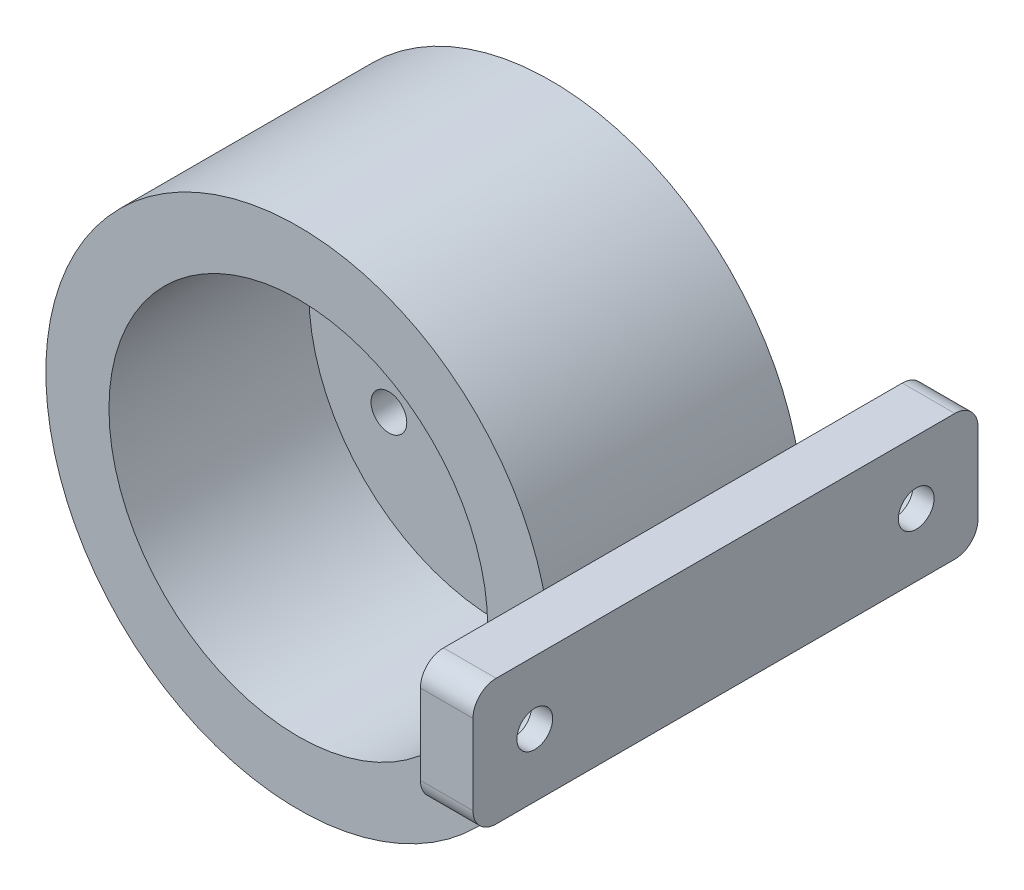
from build123d import *

# Parameters (mm, degrees)
SKETCH_1_R                = 12
EXTRUDE_1_DEPTH           = 12
SKETCH_1_4_R              = 0.85
CUT_EXTRUDE_2_DEPTH       = 2.5
SKETCH_1_5_R              = 4
EXTRUDE_2_DEPTH           = 4
SKETCH_1_6_R              = 4.3
EXTRUDE_3_DEPTH           = 0.5
SKETCH_1_7_R              = 2
CUT_EXTRUDE_3_DEPTH       = 4
SKETCH_1_8_R              = 1.5
CUT_EXTRUDE_5_DEPTH       = 1
CUT_EXTRUDE_START         = 12
SKETCH_1_10_R             = 9
CUT_EXTRUDE_6_DEPTH       = 9.5
EXTRUDE_8_DEPTH           = 0.3
EXTRUDE_8_DEPTH_BACK      = 2.2
CUT_EXTRUDE_START_2       = -2.2
CUT_EXTRUDE_20_DEPTH      = 1.5
CUT_EXTRUDE_21_DEPTH      = 1
CUT_EXTRUDE_21_DEPTH_BACK = 2
SKETCH_3_10_R             = 0.85
FILLET_3_R                = 1.1


with BuildPart() as part:
    # 草图1 → 凸台-拉伸1 (new body)
    with BuildSketch(Plane.XY):
        Circle(SKETCH_1_R)
    extrude(amount=EXTRUDE_1_DEPTH)

    # 草图1<4> → 切除-拉伸2 (cut)
    with BuildSketch(Plane.XY):
        with Locations((0, 6)):
            Circle(SKETCH_1_4_R)
        with Locations((-5.196152423, -3)):
            Circle(SKETCH_1_4_R)
        with Locations(Location((5.196152423, -3, 0), (0, 0, 180))):
            Circle(SKETCH_1_4_R)
    extrude(amount=CUT_EXTRUDE_2_DEPTH, mode=Mode.SUBTRACT)

    # 草图1<5> → 凸台-拉伸2 (add)
    with BuildSketch(Plane.XY):
        Circle(SKETCH_1_5_R)
    extrude(amount=-EXTRUDE_2_DEPTH)

    # 草图1<6> → 凸台-拉伸3 (add)
    with BuildSketch(Plane.XY):
        Circle(SKETCH_1_6_R)
    extrude(amount=-EXTRUDE_3_DEPTH)

    # 草图1<7> → 切除-拉伸3 (cut)
    with BuildSketch(Plane.XY):
        Circle(SKETCH_1_7_R)
    extrude(amount=-CUT_EXTRUDE_3_DEPTH, mode=Mode.SUBTRACT)

    # 草图1<8> → 切除-拉伸5 (cut)
    with BuildSketch(Plane.XY):
        with Locations((-5.196152423, -3)):
            Circle(SKETCH_1_8_R)
        with Locations((5.196152423, -3)):
            Circle(SKETCH_1_8_R)
        with Locations((0, 6)):
            Circle(SKETCH_1_8_R)
    extrude(amount=CUT_EXTRUDE_5_DEPTH, mode=Mode.SUBTRACT)

    # 草图1<10> → 切除-拉伸6 (cut)
    with BuildSketch(Plane.XY.offset(CUT_EXTRUDE_START)):
        Circle(SKETCH_1_10_R)
    extrude(amount=-CUT_EXTRUDE_6_DEPTH, mode=Mode.SUBTRACT)

    # 草图3 → 凸台-拉伸8 (add, two sides: drawn at the far end of the back side and taken through both)
    with BuildSketch(Plane(origin=(14, 0, 0), x_dir=(0, 0, -1), z_dir=(1, 0, 0)).offset(-EXTRUDE_8_DEPTH_BACK)):
        Polygon((-18, -3), (-12, -3), (-6, -3), (-6, 3), (-18, 3), align=None)
        Polygon((-6, 3), (-6, -3), (0, -3), (6, -3), (6, 3), align=None)
    extrude(amount=EXTRUDE_8_DEPTH + EXTRUDE_8_DEPTH_BACK)

    # 草图3<9> → 切除-拉伸20 (cut)
    with BuildSketch(Plane(origin=(14, 0, 0), x_dir=(0, 0, -1), z_dir=(1, 0, 0)).offset(CUT_EXTRUDE_START_2)):
        Polygon((-13.130266283, 0), (-14.097327984, 1.675), (-16.031451386, 1.675), (-16.998513087, 0), (-16.031451386, -1.675), (-14.097327984, -1.675), align=None)
        Polygon((1.130266283, 0), (2.097327984, 1.675), (4.031451386, 1.675), (4.998513087, 0), (4.031451386, -1.675), (2.097327984, -1.675), align=None)
    extrude(amount=CUT_EXTRUDE_20_DEPTH, mode=Mode.SUBTRACT)

    # 草图3<10> → 切除-拉伸21 (cut, two sides: drawn at the far end of the back side and taken through both)
    with BuildSketch(Plane(origin=(14, 0, 0), x_dir=(0, 0, -1), z_dir=(1, 0, 0)).offset(-CUT_EXTRUDE_21_DEPTH_BACK)):
        with Locations(Location((3.064389685, 0, 0), (0, 0, 180))):
            Circle(SKETCH_3_10_R)
        with Locations(Location((-15.064389685, 0, 0), (0, 0, 180))):
            Circle(SKETCH_3_10_R)
    extrude(amount=CUT_EXTRUDE_21_DEPTH + CUT_EXTRUDE_21_DEPTH_BACK, mode=Mode.SUBTRACT)

    # 圆角3
    fillet_3_edges = [part.edges().sort_by_distance(p)[0] for p in [
        (13.05, 3, 18),
        (13.05, -3, 18),
        (13.05, 3, -6),
        (13.05, -3, -6),
    ]]
    fillet(fillet_3_edges, radius=FILLET_3_R)


solid = part.part
